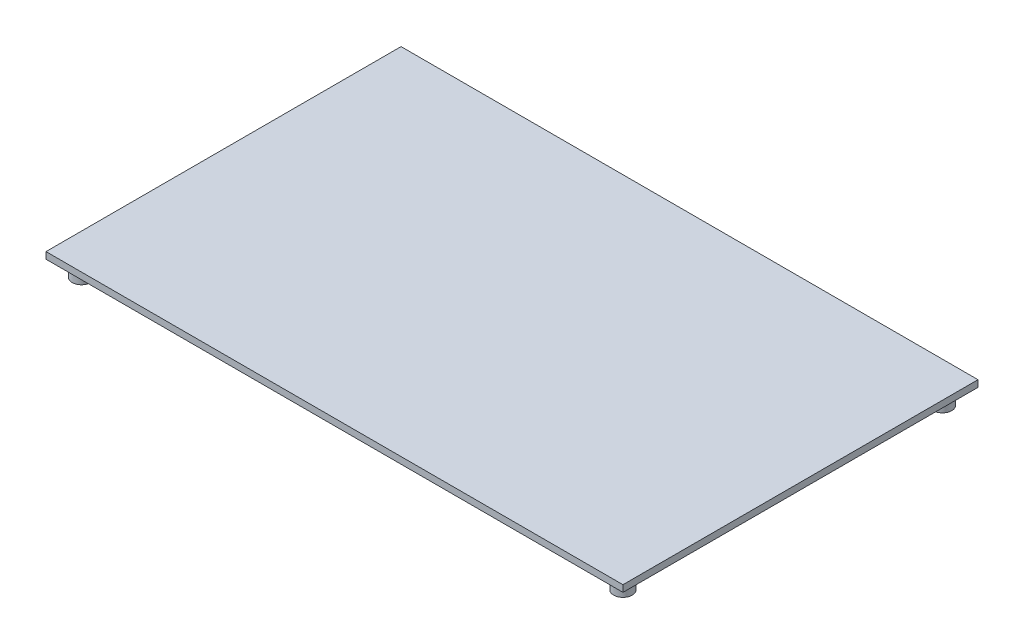
from build123d import *

# Parameters (mm, degrees)
SKETCH1_W           = 165.1
SKETCH1_H           = 101.6
BOSS_EXTRUDE1_DEPTH = 1.905
SKETCH3_R           = 2.667
BOSS_EXTRUDE2_DEPTH = 4.445


with BuildPart() as part:
    # Sketch1 → Boss-Extrude1 (new body)
    with BuildSketch(Plane(origin=(0, 0, 0), x_dir=(1, 0, 0), z_dir=(0, 1, 0))):
        with Locations((82.55, 50.8)):
            Rectangle(SKETCH1_W, SKETCH1_H)
    extrude(amount=BOSS_EXTRUDE1_DEPTH)

    # Sketch3 → Boss-Extrude2 (add)
    with BuildSketch(Plane.XZ):
        with Locations(Location((5.08, -96.52, 0), (0, 0, 270))):
            Circle(SKETCH3_R)
        with Locations(Location((5.08, -5.08, 0), (0, 0, 270))):
            Circle(SKETCH3_R)
        with Locations(Location((160.02, -5.08, 0), (0, 0, 270))):
            Circle(SKETCH3_R)
        with Locations(Location((160.02, -96.52, 0), (0, 0, 270))):
            Circle(SKETCH3_R)
        with Locations(Location((118.11, -83.82, 0), (0, 0, 270))):
            Circle(SKETCH3_R)
        with Locations(Location((60.325, -83.82, 0), (0, 0, 270))):
            Circle(SKETCH3_R)
        with Locations(Location((60.325, -34.925, 0), (0, 0, 270))):
            Circle(SKETCH3_R)
        with Locations(Location((118.11, -34.925, 0), (0, 0, 270))):
            Circle(SKETCH3_R)
    extrude(amount=BOSS_EXTRUDE2_DEPTH)


solid = part.part
